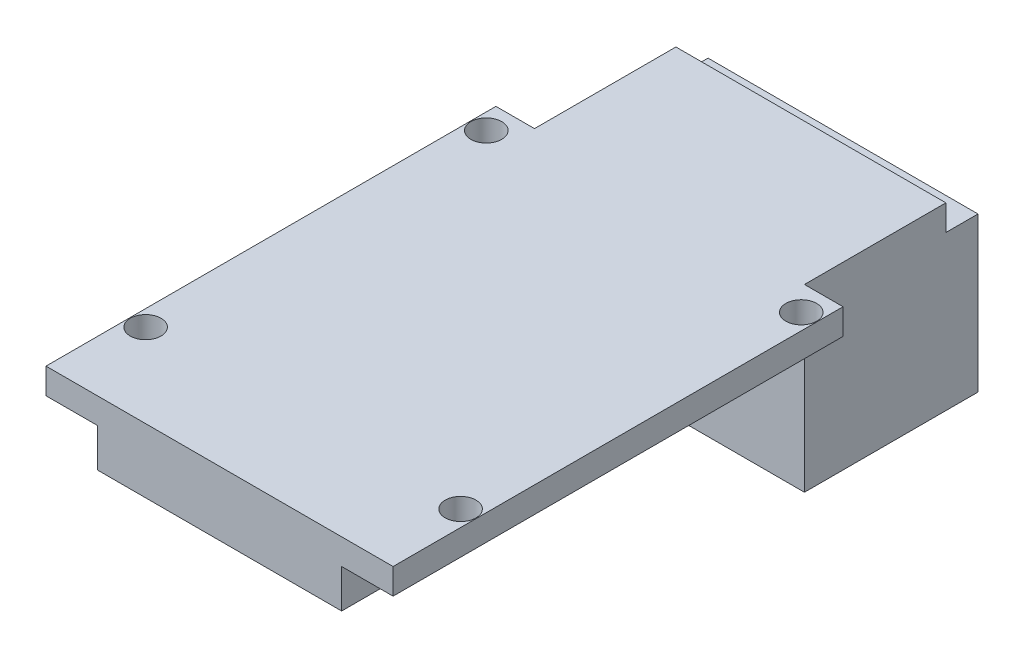
from build123d import *

# Parameters (mm, degrees)
SKETCH_1_R          = 1.2
EXTRUDE_1_DEPTH     = 2
SKETCH_2_W          = 21
SKETCH_2_H          = 13.5
EXTRUDE_2_DEPTH     = 12
SKETCH_3_R          = 4
CUT_EXTRUDE_1_DEPTH = 4
SKETCH_4_W          = 19
SKETCH_4_H          = 4
EXTRUDE_3_DEPTH     = 3
SKETCH_5_R          = 6
EXTRUDE_4_DEPTH     = 5


with BuildPart() as part:
    # 草图1 → 凸台-拉伸1 (new body)
    with BuildSketch(Plane(origin=(0, 0, 0), x_dir=(1, 0, 0), z_dir=(0, 1, 0))):
        Polygon((10.5, 17.5), (13.5, 17.5), (13.5, -17.5), (-13.5, -17.5), (-13.5, 17.5), (-10.5, 17.5), (-10.5, 28.5), (10.5, 28.5), align=None)
        with Locations(Location((12.25, -11, 0), (0, 0, 270))):
            Circle(SKETCH_1_R, mode=Mode.SUBTRACT)
        with Locations(Location((12.25, 15.5, 0), (0, 0, 270))):
            Circle(SKETCH_1_R, mode=Mode.SUBTRACT)
        with Locations(Location((-12.25, 15.5, 0), (0, 0, 90))):
            Circle(SKETCH_1_R, mode=Mode.SUBTRACT)
        with Locations(Location((-12.25, -11, 0), (0, 0, 90))):
            Circle(SKETCH_1_R, mode=Mode.SUBTRACT)
    extrude(amount=EXTRUDE_1_DEPTH)

    # 草图2 → 凸台-拉伸2 (add)
    with BuildSketch(Plane.XZ):
        with Locations((0, -24.25)):
            Rectangle(SKETCH_2_W, SKETCH_2_H)
    extrude(amount=EXTRUDE_2_DEPTH)

    # 草图3 → 切除-拉伸1 (cut)
    with BuildSketch(Plane(origin=(0, 0, -31), x_dir=(-1, 0, 0), z_dir=(0, 0, -1))):
        with Locations((0, -6)):
            Circle(SKETCH_3_R)
    extrude(amount=-CUT_EXTRUDE_1_DEPTH, mode=Mode.SUBTRACT)

    # 草图4 → 凸台-拉伸3 (add)
    with BuildSketch(Plane.XZ):
        with Locations((0, 15.5)):
            Rectangle(SKETCH_4_W, SKETCH_4_H)
    extrude(amount=EXTRUDE_3_DEPTH)

    # 草图5 → 凸台-拉伸4 (add)
    with BuildSketch(Plane.XZ):
        with Locations(Location((-3.274170516, 1.847483042, 0), (0, 0, 270))):
            Circle(SKETCH_5_R)
    extrude(amount=EXTRUDE_4_DEPTH)


solid = part.part
